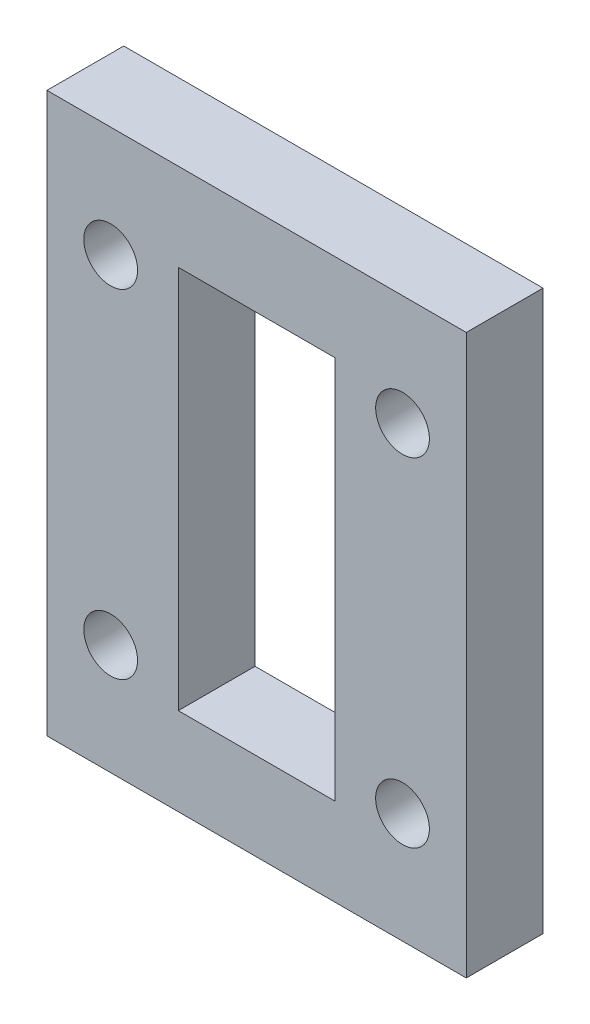
from build123d import *

# Parameters (mm, degrees)
SKETCH1_W           = 27.3
SKETCH1_H           = 36.4
SKETCH1_W_2         = 10.2
SKETCH1_H_2         = 25
BOSS_EXTRUDE1_DEPTH = 5
SKETCH2_R           = 1.75
CUT_EXTRUDE1_DEPTH  = 5


with BuildPart() as part:
    # Sketch1 → Boss-Extrude1 (new body)
    with BuildSketch(Plane.XY):
        Rectangle(SKETCH1_W, SKETCH1_H)
        Rectangle(SKETCH1_W_2, SKETCH1_H_2, mode=Mode.SUBTRACT)
    extrude(amount=BOSS_EXTRUDE1_DEPTH)

    # Sketch2 → Cut-Extrude1 (cut)
    with BuildSketch(Plane.XY.offset(5)):
        with Locations((-9.5, 11)):
            Circle(SKETCH2_R)
        with Locations(Location((9.5, 11, 0), (0, 0, 180))):
            Circle(SKETCH2_R)
        with Locations(Location((-9.5, -11, 0), (0, 0, 180))):
            Circle(SKETCH2_R)
        with Locations((9.5, -11)):
            Circle(SKETCH2_R)
    extrude(amount=-CUT_EXTRUDE1_DEPTH, mode=Mode.SUBTRACT)


solid = part.part
